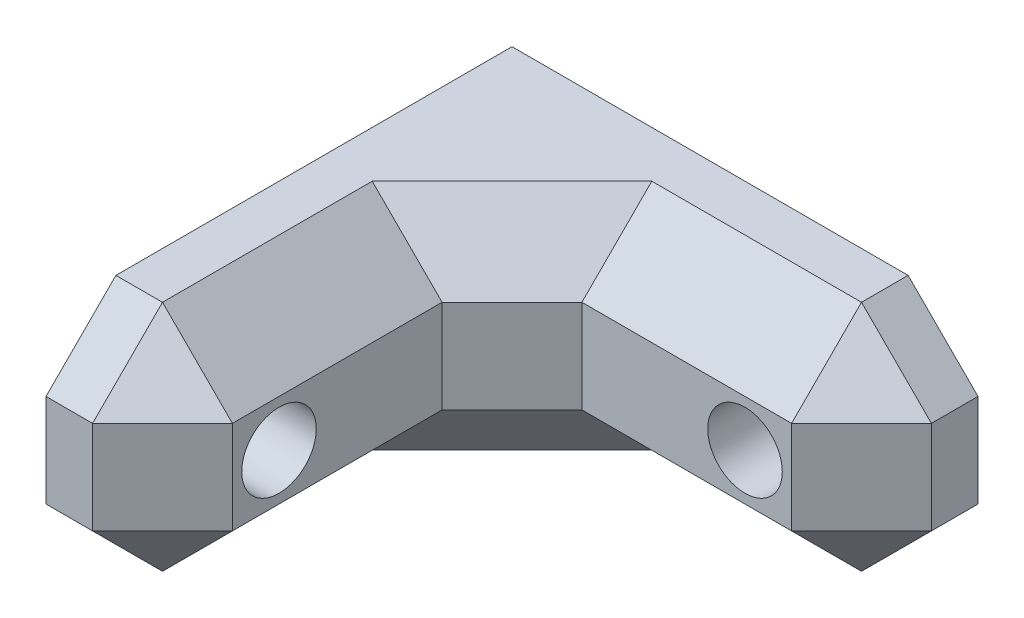
from build123d import *

# Parameters (mm, degrees)
SKIZZE1_W                       = 15
SKIZZE1_H                       = 10
SKIZZE1_R                       = 1.6
AUFSATZ_LINEAR_AUSTRAGEN1_DEPTH = 5
SKIZZE1_9_W                     = 5
SKIZZE1_9_H                     = 10
AUFSATZ_LINEAR_AUSTRAGEN2_DEPTH = 20
SKIZZE3_R                       = 1.6
SCHNITT_LINEAR_AUSTRAGEN2_DEPTH = 20
FASE1_SIZE                      = 3


with BuildPart() as part:
    # Skizze1 → Aufsatz-Linear austragen1 (new body)
    with BuildSketch(Plane.XY):
        with Locations((12.5, 5)):
            Rectangle(SKIZZE1_W, SKIZZE1_H)
        with Locations((15, 5)):
            Circle(SKIZZE1_R, mode=Mode.SUBTRACT)
    extrude(amount=AUFSATZ_LINEAR_AUSTRAGEN1_DEPTH)

    # Skizze1<9> → Aufsatz-Linear austragen2 (add)
    with BuildSketch(Plane.XY):
        with Locations((2.5, 5)):
            Rectangle(SKIZZE1_9_W, SKIZZE1_9_H)
    extrude(amount=AUFSATZ_LINEAR_AUSTRAGEN2_DEPTH)

    # Skizze3 → Schnitt-Linear austragen2 (cut)
    with BuildSketch(Plane(origin=(5, 0, 0), x_dir=(0, 0, -1), z_dir=(1, 0, 0))):
        with Locations((-15, 5)):
            Circle(SKIZZE3_R)
    extrude(amount=-SCHNITT_LINEAR_AUSTRAGEN2_DEPTH, mode=Mode.SUBTRACT)

    # Fase1
    fase1_edges = [part.edges().sort_by_distance(p)[0] for p in [
        (5, 5, 5),
        (20, 10, 2.5),
        (20, 0, 2.5),
        (2.5, 0, 20),
        (2.5, 10, 20),
        (5, 10, 12.5),
        (5, 5, 20),
        (5, 0, 12.5),
        (12.5, 10, 5),
        (12.5, 0, 5),
        (20, 5, 5),
    ]]
    chamfer(fase1_edges, length=FASE1_SIZE)


solid = part.part
